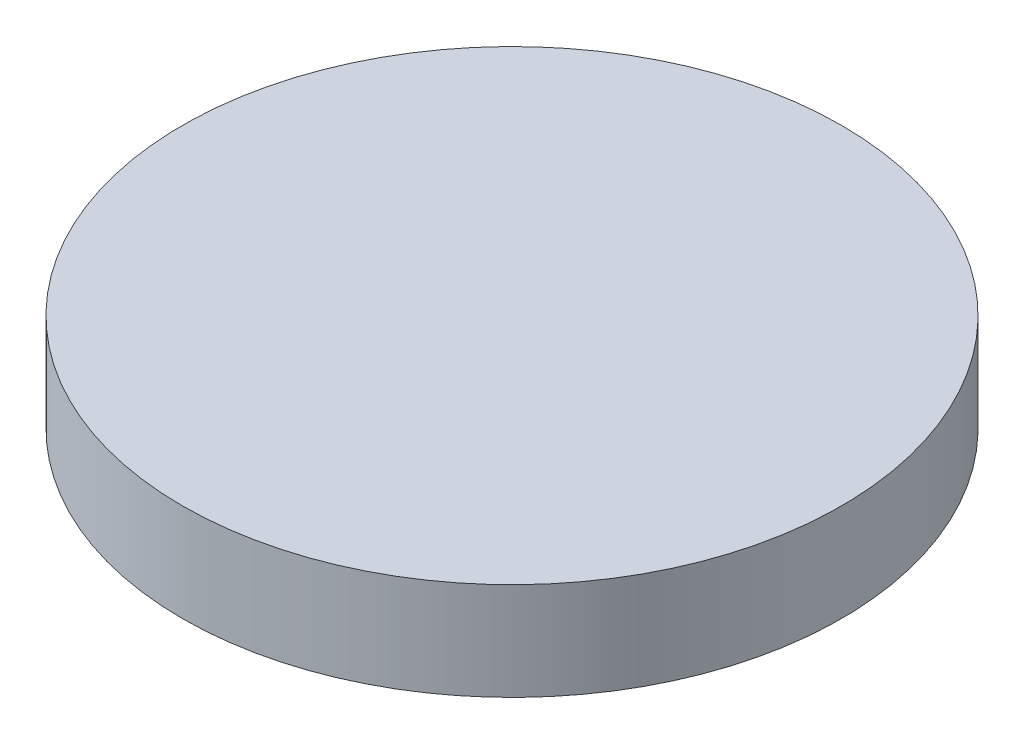
from build123d import *

# Parameters (mm, degrees)
SKETCH1_R           = 34.29
BOSS_EXTRUDE1_DEPTH = 10.16


with BuildPart() as part:
    # Sketch1 → Boss-Extrude1 (new body)
    with BuildSketch(Plane(origin=(0, 0, 0), x_dir=(1, 0, 0), z_dir=(0, 1, 0))):
        with Locations(Location((0, 0, 0), (0, 0, 270))):
            Circle(SKETCH1_R)
    extrude(amount=BOSS_EXTRUDE1_DEPTH)


solid = part.part
